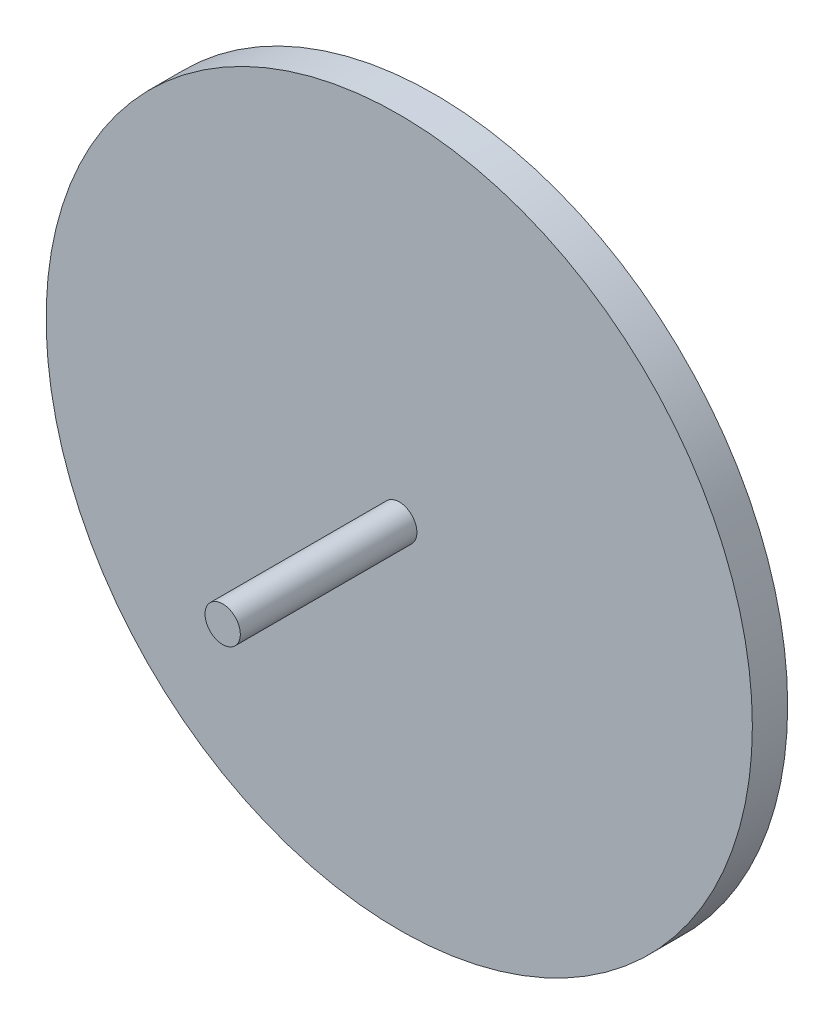
from build123d import *

# Parameters (mm, degrees)
SKETCH_1_R      = 50
EXTRUDE_1_DEPTH = 5
SKETCH_2_R      = 2.5
EXTRUDE_2_DEPTH = 25


with BuildPart() as part:
    # 草圖1 → 填料-伸長1 (new body)
    with BuildSketch(Plane.XY):
        Circle(SKETCH_1_R)
    extrude(amount=EXTRUDE_1_DEPTH)

    # 草圖2 → 填料-伸長2 (add)
    with BuildSketch(Plane.XY.offset(5)):
        Circle(SKETCH_2_R)
    extrude(amount=EXTRUDE_2_DEPTH)


solid = part.part
